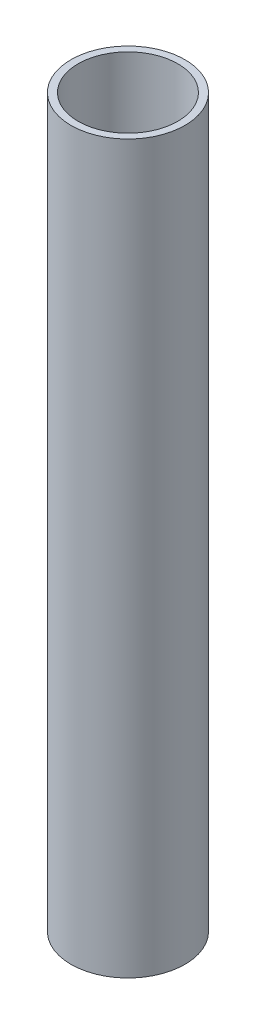
from build123d import *

# Parameters (mm, degrees)
SKETCH1_R           = 25.4
SKETCH1_R_2         = 22.225
BOSS_EXTRUDE1_DEPTH = 323.85


with BuildPart() as part:
    # Sketch1 → Boss-Extrude1 (new body)
    with BuildSketch(Plane(origin=(0, 0, 0), x_dir=(1, 0, 0), z_dir=(0, 1, 0))):
        with Locations(Location((0, 0, 0), (0, 0, 270))):
            Circle(SKETCH1_R)
        with Locations(Location((0, 0, 0), (0, 0, 270))):
            Circle(SKETCH1_R_2, mode=Mode.SUBTRACT)
    extrude(amount=BOSS_EXTRUDE1_DEPTH)


solid = part.part
